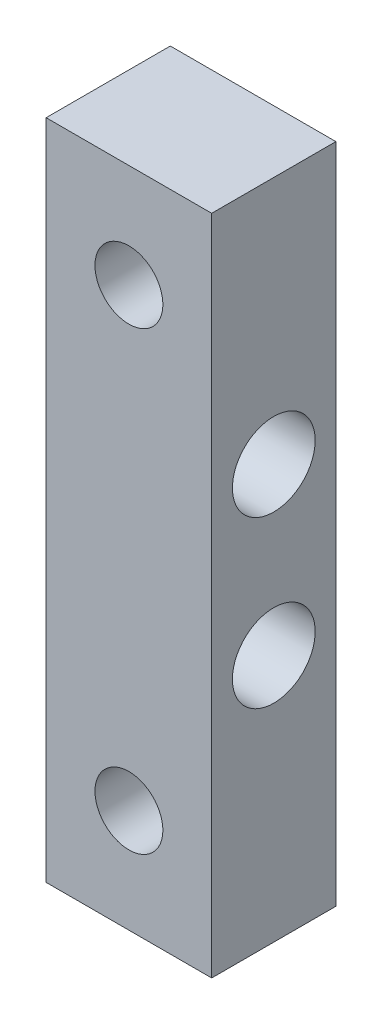
from build123d import *

# Parameters (mm, degrees)
SKETCH1_W           = 9.525
SKETCH1_H           = 50.8
SKETCH1_R           = 3.175
BOSS_EXTRUDE1_DEPTH = 12.7
CUT_EXTRUDE1_REACH  = 791.849
SKETCH2_R           = 2.6035


with BuildPart() as part:
    # Sketch1 → Boss-Extrude1 (new body)
    with BuildSketch(Plane(origin=(38.1, 0, 0), x_dir=(0, 0, -1), z_dir=(1, 0, 0))):
        with Locations((-134.9375, 762.756140976)):
            Rectangle(SKETCH1_W, SKETCH1_H)
        with Locations((-134.9375, 769.106140976)):
            Circle(SKETCH1_R, mode=Mode.SUBTRACT)
        with Locations(Location((-134.9375, 756.406140976, 0), (0, 0, 180))):
            Circle(SKETCH1_R, mode=Mode.SUBTRACT)
    extrude(amount=BOSS_EXTRUDE1_DEPTH)

    # Sketch2 → Cut-Extrude1 (cut, up to next)
    with BuildSketch(Plane(origin=(0, 0, 130.175), x_dir=(-1, 0, 0), z_dir=(0, 0, -1)), mode=Mode.PRIVATE) as cut_extrude1_sk1:
        with Locations(Location((-44.45, 780.218640976, 0), (0, 0, 90))):
            Circle(SKETCH2_R)
    cut_extrude1_tool1 = extrude(cut_extrude1_sk1.sketch, amount=-CUT_EXTRUDE1_REACH, mode=Mode.PRIVATE) & part.part
    # Sketch2 → Cut-Extrude1 (cut, up to next)
    with BuildSketch(Plane(origin=(0, 0, 130.175), x_dir=(-1, 0, 0), z_dir=(0, 0, -1)), mode=Mode.PRIVATE) as cut_extrude1_sk2:
        with Locations(Location((-44.45, 745.293640976, 0), (0, 0, 90))):
            Circle(SKETCH2_R)
    cut_extrude1_tool2 = extrude(cut_extrude1_sk2.sketch, amount=-CUT_EXTRUDE1_REACH, mode=Mode.PRIVATE) & part.part
    add(cut_extrude1_tool1.solids().sort_by_distance((44.45, 780.218641, 130.175))[0], mode=Mode.SUBTRACT)
    add(cut_extrude1_tool2.solids().sort_by_distance((44.45, 745.293641, 130.175))[0], mode=Mode.SUBTRACT)


solid = part.part
